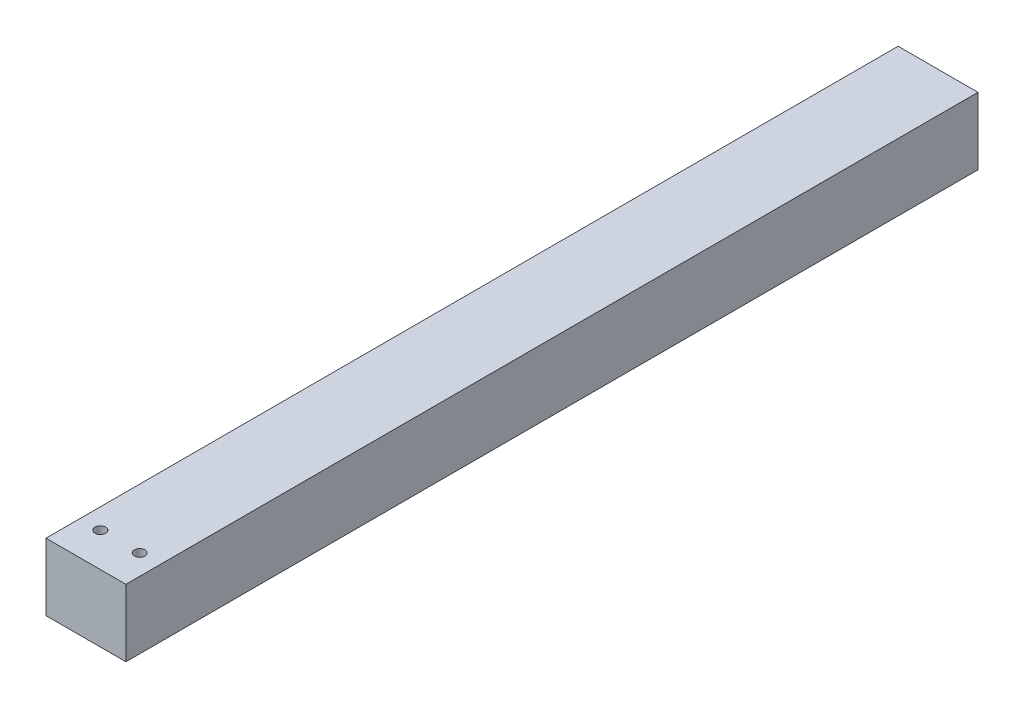
from build123d import *

# Parameters (mm, degrees)
ESQUISSE1_W             = 75
ESQUISSE1_H             = 63
BOSS_EXTRU_1_DEPTH      = 800
ESQUISSE2_R             = 5
ENL_V_MAT_EXTRU_1_DEPTH = 806.973944988


with BuildPart() as part:
    # Esquisse1 → Boss.-Extru.1 (new body)
    with BuildSketch(Plane.XY):
        with Locations((37.5, 31.5)):
            Rectangle(ESQUISSE1_W, ESQUISSE1_H)
    extrude(amount=BOSS_EXTRU_1_DEPTH)

    # Esquisse2 → Enlèv. mat.-Extru.1 (cut, through all)
    with BuildSketch(Plane.XZ):
        with Locations(Location((19, 768, 0), (0, 0, 270))):
            Circle(ESQUISSE2_R)
        with Locations(Location((56, 768, 0), (0, 0, 90))):
            Circle(ESQUISSE2_R)
    extrude(amount=-ENL_V_MAT_EXTRU_1_DEPTH, mode=Mode.SUBTRACT)


solid = part.part
